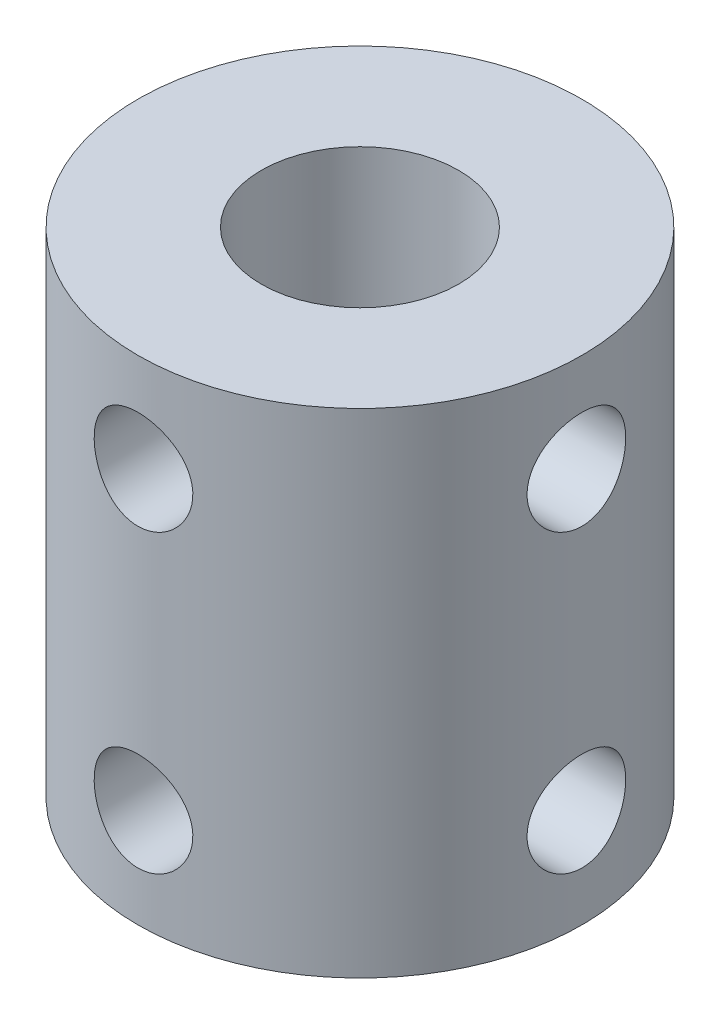
from build123d import *

# Parameters (mm, degrees)
SKETCH1_R           = 4.5
SKETCH1_R_2         = 2
BOSS_EXTRUDE1_DEPTH = 10
SKETCH2_R           = 1
CUT_EXTRUDE1_DEPTH  = 12.853269591


with BuildPart() as part:
    # Sketch1 → Boss-Extrude1 (new body)
    with BuildSketch(Plane(origin=(0, 0, 0), x_dir=(1, 0, 0), z_dir=(0, 1, 0))):
        Circle(SKETCH1_R)
        Circle(SKETCH1_R_2, mode=Mode.SUBTRACT)
    extrude(amount=BOSS_EXTRUDE1_DEPTH)

    # Sketch2 → Cut-Extrude1 (cut, through all)
    with BuildSketch(Plane.XY):
        with Locations((0, 8)):
            Circle(SKETCH2_R)
        with Locations((0, 2)):
            Circle(SKETCH2_R)
    cut_extrude1 = extrude(amount=CUT_EXTRUDE1_DEPTH, mode=Mode.SUBTRACT)

    # Mirror1: Cut-Extrude1 across plane
    add(cut_extrude1.mirror(Plane(origin=(0, 0, 0), x_dir=(0.7071067811865465, 0, 0.7071067811865486), z_dir=(-0.7071067811865488, 0, 0.7071067811865464))), mode=Mode.SUBTRACT)


solid = part.part
